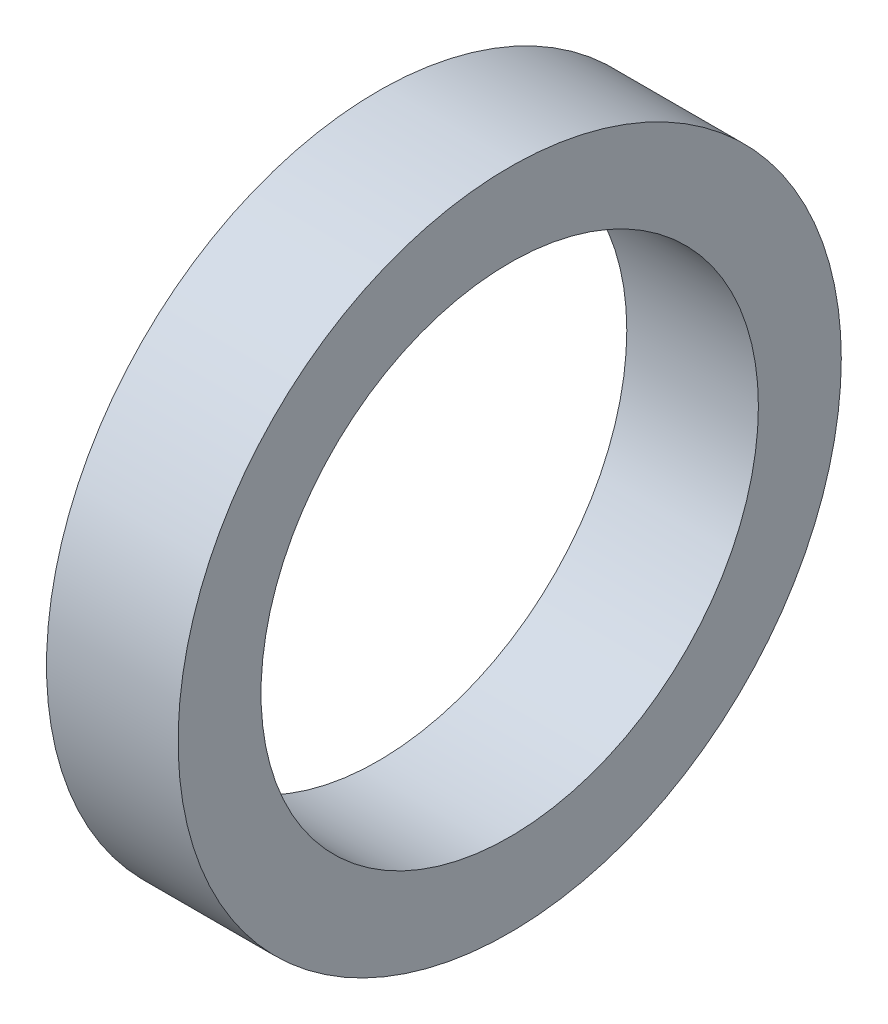
from build123d import *

# Parameters (mm, degrees)
SKETCH1_R           = 2
SKETCH1_R_2         = 1.5
BOSS_EXTRUDE1_DEPTH = 0.79375


with BuildPart() as part:
    # Sketch1 → Boss-Extrude1 (new body)
    with BuildSketch(Plane(origin=(0, 0, 0), x_dir=(0, 0, -1), z_dir=(1, 0, 0))):
        Circle(SKETCH1_R)
        Circle(SKETCH1_R_2, mode=Mode.SUBTRACT)
    extrude(amount=BOSS_EXTRUDE1_DEPTH)


solid = part.part
